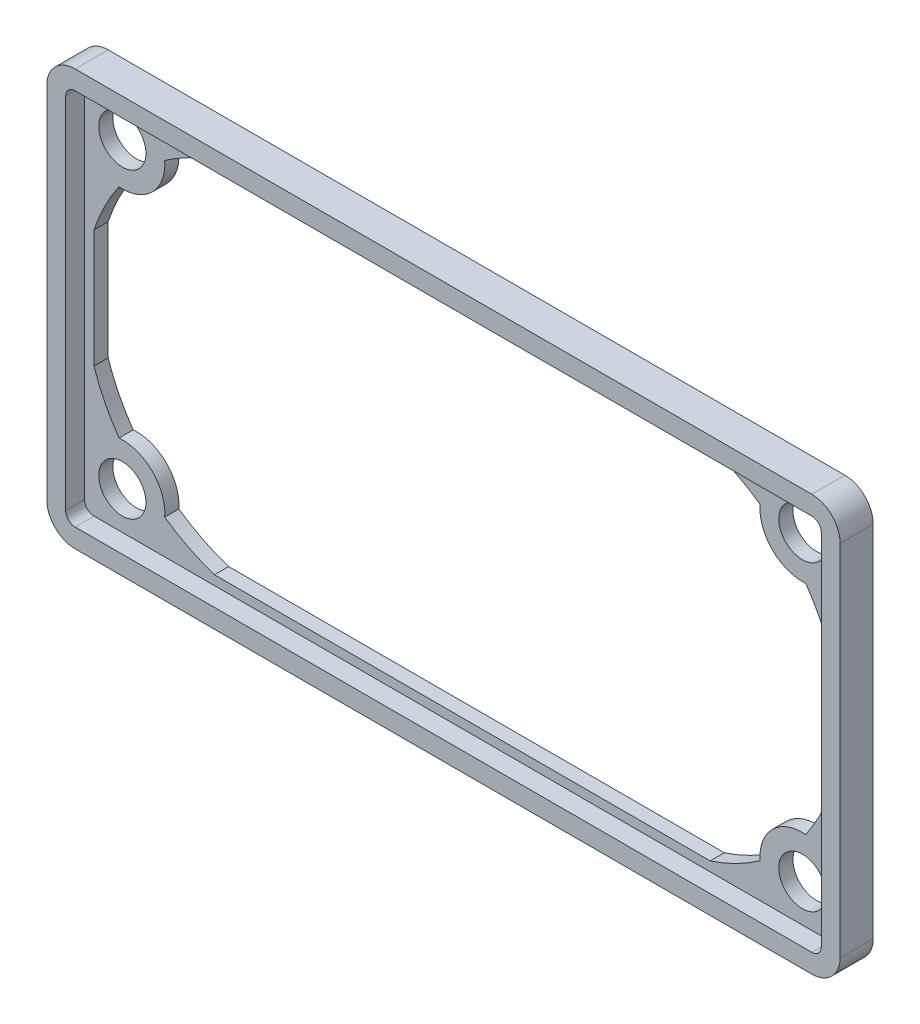
from build123d import *

# Parameters (mm, degrees)
SKETCH1_R           = 2.5
BOSS_EXTRUDE1_DEPTH = 1.5
BOSS_EXTRUDE2_DEPTH = 3.5


with BuildPart() as part:
    # Sketch1 → Boss-Extrude1 (new body)
    with BuildSketch(Plane.XY):
        with BuildLine():
            Line((39, 20), (-39, 20))
            ThreePointArc((-39, 20), (-39.707106781, 19.707106781), (-40, 19))
            Line((-40, 19), (-40, -19))
            ThreePointArc((-40, -19), (-39.707106781, -19.707106781), (-39, -20))
            Line((-39, -20), (39, -20))
            ThreePointArc((39, -20), (39.707106781, -19.707106781), (40, -19))
            Line((40, -19), (40, 19))
            ThreePointArc((40, 19), (39.707106781, 19.707106781), (39, 20))
        make_face()
        with Locations((-36, 16)):
            Circle(SKETCH1_R, mode=Mode.SUBTRACT)
        with Locations((-36, -16)):
            Circle(SKETCH1_R, mode=Mode.SUBTRACT)
        with Locations(Location((36, -16, 0), (0, 0, 180))):
            Circle(SKETCH1_R, mode=Mode.SUBTRACT)
        with Locations(Location((36, 16, 0), (0, 0, 180))):
            Circle(SKETCH1_R, mode=Mode.SUBTRACT)
        with BuildLine():
            Line((26.244997998, 19), (-26.244997998, 19))
            ThreePointArc((-26.244997998, 19), (-28.977515605, 17.871883325), (-31.513890212, 16.353297288))
            ThreePointArc((-31.513890212, 16.353297288), (-32.818019485, 12.818019485), (-36.353297288, 11.513890212))
            ThreePointArc((-36.353297288, 11.513890212), (-37.871883325, 8.977515605), (-39, 6.244997998))
            Line((-39, 6.244997998), (-39, -6.244997998))
            ThreePointArc((-39, -6.244997998), (-37.871883325, -8.977515605), (-36.353297288, -11.513890212))
            ThreePointArc((-36.353297288, -11.513890212), (-32.818019485, -12.818019485), (-31.513890212, -16.353297288))
            ThreePointArc((-31.513890212, -16.353297288), (-28.977515605, -17.871883325), (-26.244997998, -19))
            Line((-26.244997998, -19), (26.244997998, -19))
            ThreePointArc((26.244997998, -19), (28.977515605, -17.871883325), (31.513890212, -16.353297288))
            ThreePointArc((31.513890212, -16.353297288), (32.818019485, -12.818019485), (36.353297288, -11.513890212))
            ThreePointArc((36.353297288, -11.513890212), (37.871883325, -8.977515605), (39, -6.244997998))
            Line((39, -6.244997998), (39, 6.244997998))
            ThreePointArc((39, 6.244997998), (37.871883325, 8.977515605), (36.353297288, 11.513890212))
            ThreePointArc((36.353297288, 11.513890212), (32.818019485, 12.818019485), (31.513890212, 16.353297288))
            ThreePointArc((31.513890212, 16.353297288), (28.977515605, 17.871883325), (26.244997998, 19))
        make_face(mode=Mode.SUBTRACT)
    extrude(amount=BOSS_EXTRUDE1_DEPTH)

    # Sketch2 → Boss-Extrude2 (add)
    with BuildSketch(Plane(origin=(0, 0, 0), x_dir=(-1, 0, 0), z_dir=(0, 0, -1))):
        with BuildLine():
            Line((39, 22), (-39, 22))
            ThreePointArc((-39, 22), (-41.121320344, 21.121320344), (-42, 19))
            Line((-42, 19), (-42, -19))
            ThreePointArc((-42, -19), (-41.121320344, -21.121320344), (-39, -22))
            Line((-39, -22), (39, -22))
            ThreePointArc((39, -22), (41.121320344, -21.121320344), (42, -19))
            Line((42, -19), (42, 19))
            ThreePointArc((42, 19), (41.121320344, 21.121320344), (39, 22))
        make_face()
        with BuildLine():
            Line((40, -19), (40, 19))
            ThreePointArc((40, 19), (39.707106781, 19.707106781), (39, 20))
            Line((39, 20), (-39, 20))
            ThreePointArc((-39, 20), (-39.707106781, 19.707106781), (-40, 19))
            Line((-40, 19), (-40, -19))
            ThreePointArc((-40, -19), (-39.707106781, -19.707106781), (-39, -20))
            Line((-39, -20), (39, -20))
            ThreePointArc((39, -20), (39.707106781, -19.707106781), (40, -19))
        make_face(mode=Mode.SUBTRACT)
    extrude(amount=-BOSS_EXTRUDE2_DEPTH)


solid = part.part
